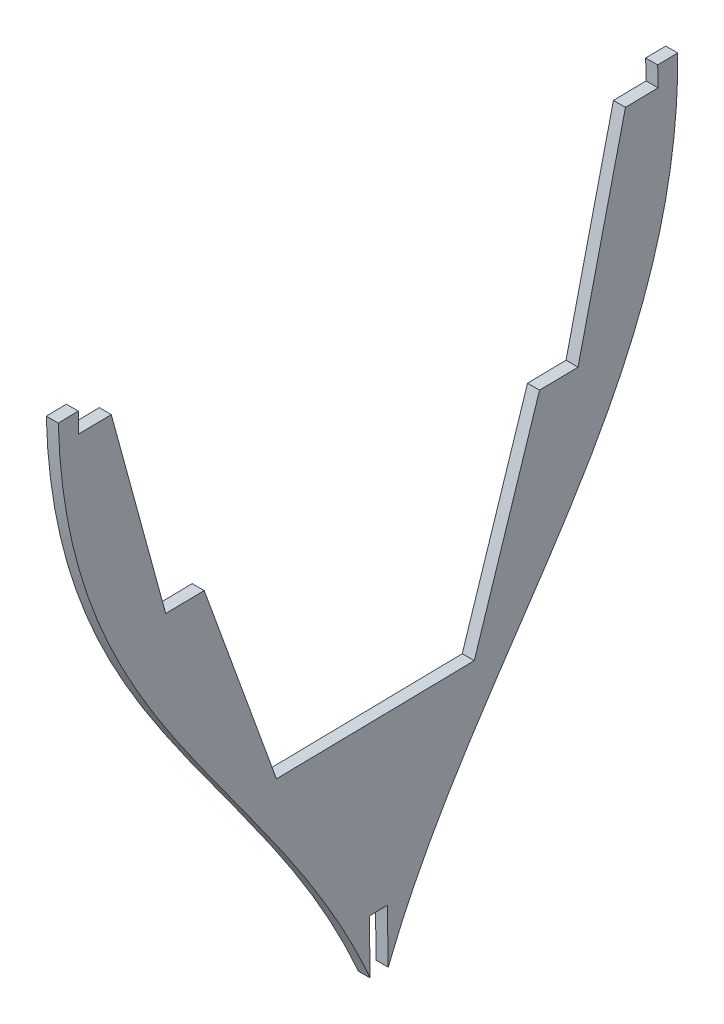
from build123d import *

# Parameters (mm, degrees)
BOSS_EXTRU_3_DEPTH      = 6
ENL_V_MAT_EXTRU_1_DEPTH = 6


with BuildPart() as part:
    # Esquisse2 → Boss.-Extru.3 (new body)
    with BuildSketch(Plane(origin=(0, 0, 0), x_dir=(0, 0, -1), z_dir=(1, 0, 0))):
        with BuildLine():
            Line((148.243380773, 362.223341232), (138.244905535, 362.048719019))
            Line((138.244905535, 362.048719019), (138.419527748, 352.050243781))
            Line((138.419527748, 352.050243781), (122.159087501, 351.766257074))
            Line((122.159087501, 351.766257074), (98.494847202, 251.33771391))
            Line((98.494847202, 251.33771391), (79.294342883, 251.002379324))
            Line((79.294342883, 251.002379324), (46.73067621, 150.418408708))
            Line((46.73067621, 150.418408708), (-51.954655196, 148.694880815))
            Line((-51.954655196, 148.694880815), (-88.010766127, 248.080414957))
            Line((-88.010766127, 248.080414957), (-107.211270446, 247.745080371))
            Line((-107.211270446, 247.745080371), (-134.367955003, 347.286041964))
            Line((-134.367955003, 347.286041964), (-150.628395251, 347.002055257))
            Line((-150.628395251, 347.002055257), (-150.803017464, 357.000530495))
            Line((-150.803017464, 357.000530495), (-160.801492701, 356.825908282))
            add(Edge.make_bspline(
                [(-160.801492701, 356.825908282), (-156.907041043, 210.30293187), (-48.312567093, 149.933153379), (-0.487215218, 27.896847792)],
                knots=[0, 0, 0, 0, 1, 1, 1, 1], degree=3))
            add(Edge.make_bspline(
                [(148.243380773, 362.223341232), (149.467757199, 215.653732265), (43.04756988, 151.528747598), (-0.487215218, 27.896847792)],
                knots=[0, 0, 0, 0, 1, 1, 1, 1], degree=3))
        make_face()
    extrude(amount=BOSS_EXTRU_3_DEPTH)

    # Esquisse3 → Enlèv. mat.-Extru.1 (cut)
    with BuildSketch(Plane(origin=(6, 0, 0), x_dir=(0, 0, -1), z_dir=(1, 0, 0))):
        Polygon((-5.186345745, 39.259320978), (-5.65782572, 66.255204121), (3.340801994, 66.412364112), (3.812281969, 39.41648097), (22.081846162, 18.731742949), (-23.028999283, 18.731742949), align=None)
    extrude(amount=-ENL_V_MAT_EXTRU_1_DEPTH, mode=Mode.SUBTRACT)


solid = part.part
